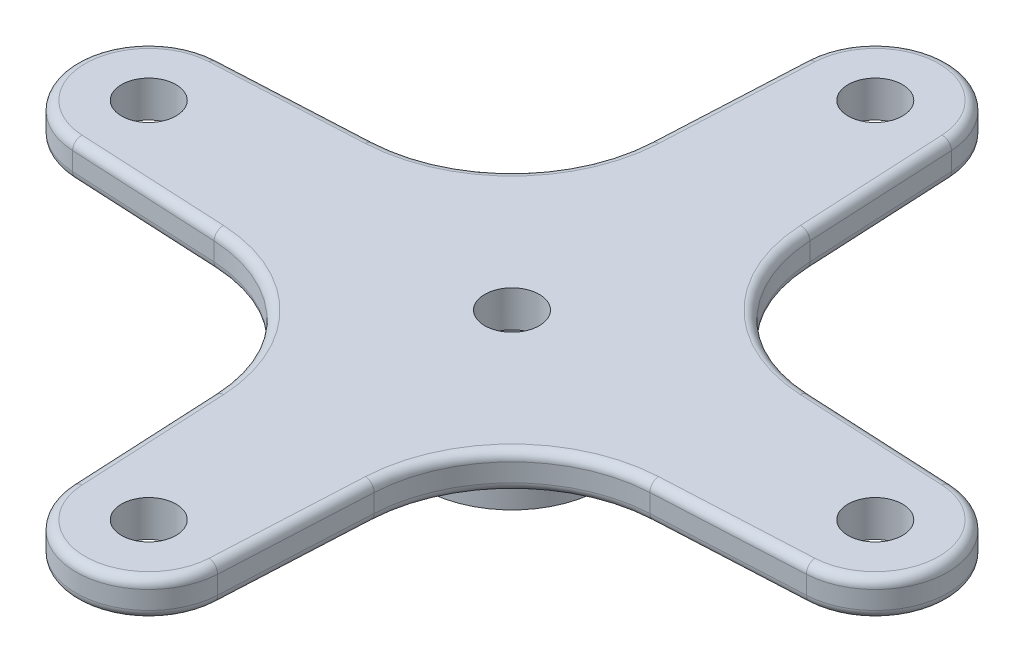
from build123d import *

# Parameters (mm, degrees)
SKETCH1_R           = 5
SKETCH1_R_2         = 3
BOSS_EXTRUDE1_DEPTH = 4
SKETCH5_R           = 1.5
BOSS_EXTRUDE3_DEPTH = 2
SKETCH6_R           = 1.5
CUT_EXTRUDE1_DEPTH  = 35.467375879
FILLET1_R           = 0.5
FILLET2_R           = 0.5


with BuildPart() as part:
    # Sketch1 → Boss-Extrude1 (new body)
    with BuildSketch(Plane(origin=(0, 0, 0), x_dir=(1, 0, 0), z_dir=(0, 1, 0))):
        with Locations(Location((0, 0, 0), (0, 0, 270))):
            Circle(SKETCH1_R)
        with Locations(Location((0, 0, 0), (0, 0, 270))):
            Circle(SKETCH1_R_2, mode=Mode.SUBTRACT)
    extrude(amount=BOSS_EXTRUDE1_DEPTH)

    # Sketch5 → Boss-Extrude3 (add)
    with BuildSketch(Plane(origin=(0, 4, 0), x_dir=(1, 0, 0), z_dir=(0, 1, 0))):
        with BuildLine():
            Line((-3.994996871, 20.2), (-4.405724681, 11.995718423))
            ThreePointArc((-4.405724681, 11.995718423), (-6.738864174, 6.738864174), (-11.995718423, 4.405724681))
            Line((-11.995718423, 4.405724681), (-20.2, 3.994996871))
            ThreePointArc((-20.2, 3.994996871), (-24, 0), (-20.2, -3.994996871))
            Line((-20.2, -3.994996871), (-11.995718423, -4.405724681))
            ThreePointArc((-11.995718423, -4.405724681), (-6.738864174, -6.738864174), (-4.405724681, -11.995718423))
            Line((-4.405724681, -11.995718423), (-3.994996871, -20.2))
            ThreePointArc((-3.994996871, -20.2), (0, -24), (3.994996871, -20.2))
            Line((3.994996871, -20.2), (4.405724681, -11.995718423))
            ThreePointArc((4.405724681, -11.995718423), (6.738864174, -6.738864174), (11.995718423, -4.405724681))
            Line((11.995718423, -4.405724681), (20.2, -3.994996871))
            ThreePointArc((20.2, -3.994996871), (24, 0), (20.2, 3.994996871))
            Line((20.2, 3.994996871), (11.995718423, 4.405724681))
            ThreePointArc((11.995718423, 4.405724681), (6.738864174, 6.738864174), (4.405724681, 11.995718423))
            Line((4.405724681, 11.995718423), (3.994996871, 20.2))
            ThreePointArc((3.994996871, 20.2), (0, 24), (-3.994996871, 20.2))
        make_face()
        with Locations(Location((0, 20, 0), (0, 0, 270))):
            Circle(SKETCH5_R, mode=Mode.SUBTRACT)
        with Locations(Location((20, 0, 0), (0, 0, 270))):
            Circle(SKETCH5_R, mode=Mode.SUBTRACT)
        with Locations(Location((0, -20, 0), (0, 0, 270))):
            Circle(SKETCH5_R, mode=Mode.SUBTRACT)
        with Locations(Location((-20, 0, 0), (0, 0, 270))):
            Circle(SKETCH5_R, mode=Mode.SUBTRACT)
    extrude(amount=BOSS_EXTRUDE3_DEPTH)

    # Sketch6 → Cut-Extrude1 (cut, through all)
    with BuildSketch(Plane(origin=(0, 6, 0), x_dir=(1, 0, 0), z_dir=(0, 1, 0))):
        with Locations(Location((0, 0, 0), (0, 0, 270))):
            Circle(SKETCH6_R)
    extrude(amount=-CUT_EXTRUDE1_DEPTH, mode=Mode.SUBTRACT)

    # Fillet1
    fillet1_edges = [part.edges().sort_by_distance(p)[0] for p in [
        (0, 6, 24),
        (4.200360776, 6, 16.097859212),
        (6.738864174, 6, 6.738864174),
        (16.097859212, 6, 4.200360776),
        (24, 6, 0),
        (16.097859212, 6, -4.200360776),
        (6.738864174, 6, -6.738864174),
        (4.200360776, 6, -16.097859212),
        (0, 6, -24),
        (-4.200360776, 6, -16.097859212),
        (-6.738864174, 6, -6.738864174),
        (-16.097859212, 6, -4.200360776),
        (-24, 6, 0),
        (-16.097859212, 6, 4.200360776),
        (-6.738864174, 4, 6.738864174),
        (-4.200360776, 4, 16.097859212),
        (0, 4, 24),
        (4.200360776, 4, 16.097859212),
        (6.738864174, 4, 6.738864174),
        (16.097859212, 4, 4.200360776),
        (24, 4, 0),
        (16.097859212, 4, -4.200360776),
        (6.738864174, 4, -6.738864174),
        (4.200360776, 4, -16.097859212),
        (0, 4, -24),
        (-4.200360776, 4, -16.097859212),
        (-6.738864174, 4, -6.738864174),
        (-16.097859212, 4, -4.200360776),
        (-24, 4, 0),
        (-16.097859212, 4, 4.200360776),
        (-6.738864174, 6, 6.738864174),
        (-4.200360776, 6, 16.097859212),
    ]]
    fillet(fillet1_edges, radius=FILLET1_R)

    # Fillet2
    fillet2_edges = [part.edges().sort_by_distance(p)[0] for p in [
        (0, 4, -5),
    ]]
    fillet(fillet2_edges, radius=FILLET2_R)


solid = part.part
